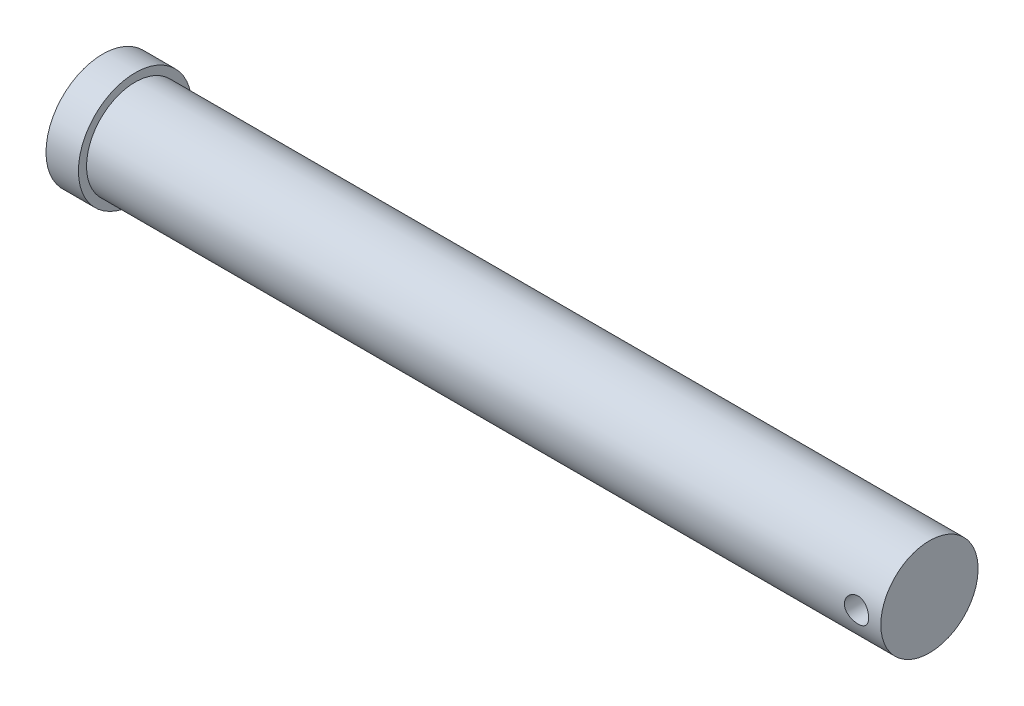
from build123d import *

# Parameters (mm, degrees)
IZIM2_R               = 7.5
KES_EKSTR_ZYON1_DEPTH = 30


with BuildPart() as part:
    # Çizim1 → Döndür1 (revolve)
    with BuildSketch(Plane.XY, mode=Mode.PRIVATE) as d_nd_r1_sk:
        Polygon((0, 0), (0, 35), (20, 35), (20, 30), (510, 30), (510, 0), align=None)
    revolve(d_nd_r1_sk.sketch.rotate(Axis((0, 0, 0), (1, 0, 0)), 90), axis=Axis((0, 0, 0), (1, 0, 0)))

    # Çizim2 → Kes-Ekstrüzyon1 (cut, symmetric)
    with BuildSketch(Plane.XY):
        with Locations((495, 0)):
            Circle(IZIM2_R)
    extrude(amount=KES_EKSTR_ZYON1_DEPTH, both=True, mode=Mode.SUBTRACT)


solid = part.part
